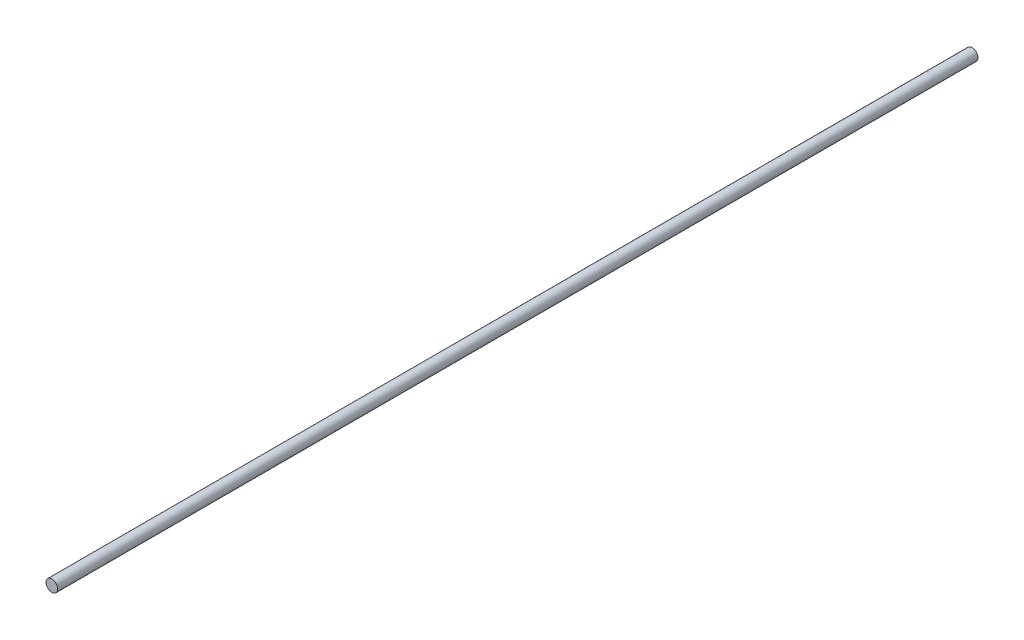
from build123d import *

# Parameters (mm, degrees)
IZIM1_R                     = 4
Y_KSEKLIK_EKSTR_ZYON1_DEPTH = 630


with BuildPart() as part:
    # Çizim1 → Yükseklik-Ekstrüzyon1 (new body)
    with BuildSketch(Plane.XY):
        Circle(IZIM1_R)
    extrude(amount=Y_KSEKLIK_EKSTR_ZYON1_DEPTH)


solid = part.part
